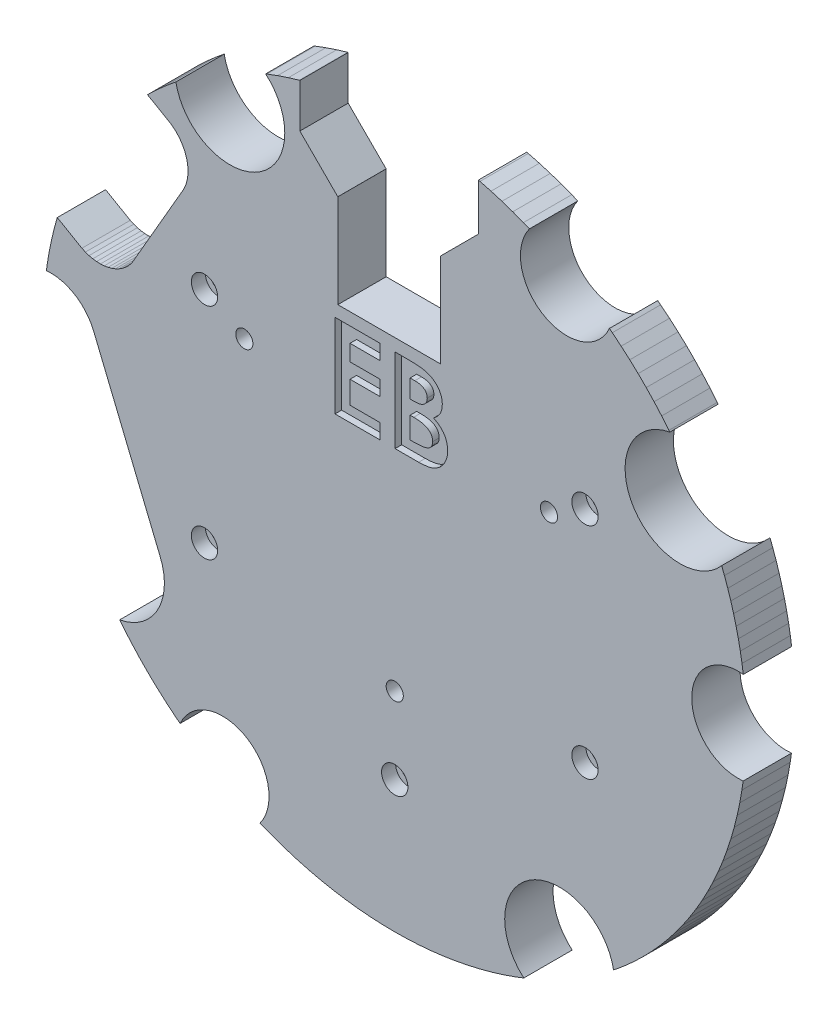
from build123d import *

# Parameters (mm, degrees)
DODANIE_WYCI_GNI_CIE1_DEPTH   = 5
DODANIE_WYCI_GNI_CIE1_2_DEPTH = 5
DODANIE_WYCI_GNI_CIE1_3_DEPTH = 5
DODANIE_WYCI_GNI_CIE1_4_DEPTH = 5
DODANIE_WYCI_GNI_CIE1_5_DEPTH = 5
DODANIE_WYCI_GNI_CIE1_6_DEPTH = 5
DODANIE_WYCI_GNI_CIE2_START   = 5
EB_R                          = 1.59999934
DODANIE_WYCI_GNI_CIE2_DEPTH   = 11
CUT_EXTRUDE2_DEPTH            = 1.5
CUT_EXTRUDE3_START            = -18
CUT_EXTRUDE3_DEPTH            = 18
SZKIC9_R                      = 72.406318029
WYTNIJ_WYCI_GNI_CIE3_DEPTH    = 5
SZKIC10_R                     = 1.95
WYTNIJ_WYCI_GNI_CIE4_DEPTH    = 6
SZKIC11_R                     = 1.6
WYTNIJ_WYCI_GNI_CIE5_DEPTH    = 114.216129925
SZKIC12_R                     = 3
WYTNIJ_WYCI_GNI_CIE6_DEPTH    = 3.2


with BuildPart() as part:
    # mandaryna baza → Dodanie-wyciągnięcie1 (new body)
    with BuildSketch(Plane.XY):
        with BuildLine():
            Line((16.907164233, 3.25), (54.903893305, 3.25))
            ThreePointArc((54.903893305, 3.25), (47.631397208, 27.5), (30.266529215, 45.923166368))
            Line((30.266529215, 45.923166368), (11.268164679, 13.017033731))
            ThreePointArc((11.268164679, 13.017033731), (11.268164679, 6.50567791), (16.907164233, 3.25))
        make_face()
    extrude(amount=DODANIE_WYCI_GNI_CIE1_DEPTH)



with BuildPart() as body_2:
    # mandaryna baza → Dodanie-wyci_gni_cie1 2 (new body)
    with BuildSketch(Plane.XY):
        with BuildLine():
            Line((5.638999554, 16.267033731), (24.63736409, 49.173166368))
            ThreePointArc((24.63736409, 49.173166368), (17.789613857, 52.043535995), (10.61764744, 53.9654108))
            Line((10.61764744, 53.9654108), (10.61764744, 36.95114998))
            Line((10.61764744, 36.95114998), (-13.15035256, 36.95114998))
            Line((-13.15035256, 36.95114998), (-13.15035256, 53.404758473))
            ThreePointArc((-13.15035256, 53.404758473), (-19.011956116, 51.609548774), (-24.63736409, 49.173166368))
            Line((-24.63736409, 49.173166368), (-5.638999554, 16.267033731))
            ThreePointArc((-5.638999554, 16.267033731), (0, 13.011355821), (5.638999554, 16.267033731))
        make_face()
    extrude(amount=DODANIE_WYCI_GNI_CIE1_2_DEPTH)


with BuildPart() as body_3:
    # mandaryna baza → Dodanie-wyci_gni_cie1 3 (new body)
    with BuildSketch(Plane.XY):
        with BuildLine():
            Line((-11.268164679, 13.017033731), (-30.266529215, 45.923166368))
            ThreePointArc((-30.266529215, 45.923166368), (-47.631397208, 27.5), (-54.903893305, 3.25))
            Line((-54.903893305, 3.25), (-16.907164233, 3.25))
            ThreePointArc((-16.907164233, 3.25), (-11.268164679, 6.50567791), (-11.268164679, 13.017033731))
        make_face()
    extrude(amount=DODANIE_WYCI_GNI_CIE1_3_DEPTH)


with BuildPart() as body_4:
    # mandaryna baza → Dodanie-wyci_gni_cie1 4 (new body)
    with BuildSketch(Plane.XY):
        with BuildLine():
            Line((-16.907164233, -3.25), (-54.903893305, -3.25))
            ThreePointArc((-54.903893305, -3.25), (-47.631397208, -27.5), (-30.266529215, -45.923166368))
            Line((-30.266529215, -45.923166368), (-11.268164679, -13.017033731))
            ThreePointArc((-11.268164679, -13.017033731), (-11.268164679, -6.50567791), (-16.907164233, -3.25))
        make_face()
    extrude(amount=DODANIE_WYCI_GNI_CIE1_4_DEPTH)


with BuildPart() as body_5:
    # mandaryna baza → Dodanie-wyci_gni_cie1 5 (new body)
    with BuildSketch(Plane.XY):
        with BuildLine():
            Line((-5.638999554, -16.267033731), (-24.63736409, -49.173166368))
            ThreePointArc((-24.63736409, -49.173166368), (0, -55), (24.63736409, -49.173166368))
            Line((24.63736409, -49.173166368), (5.638999554, -16.267033731))
            ThreePointArc((5.638999554, -16.267033731), (0, -13.011355821), (-5.638999554, -16.267033731))
        make_face()
    extrude(amount=DODANIE_WYCI_GNI_CIE1_5_DEPTH)


with BuildPart() as body_6:
    # mandaryna baza → Dodanie-wyci_gni_cie1 6 (new body)
    with BuildSketch(Plane.XY):
        with BuildLine():
            Line((11.268164679, -13.017033731), (30.266529215, -45.923166368))
            ThreePointArc((30.266529215, -45.923166368), (47.631397208, -27.5), (54.903893305, -3.25))
            Line((54.903893305, -3.25), (16.907164233, -3.25))
            ThreePointArc((16.907164233, -3.25), (11.268164679, -6.50567791), (11.268164679, -13.017033731))
        make_face()
    extrude(amount=DODANIE_WYCI_GNI_CIE1_6_DEPTH)


with BuildPart() as part_1:
    add(part.part)

    add(body_2.part)  # Dodanie-wyciągnięcie2 merges body 2

    add(body_3.part)  # Dodanie-wyciągnięcie2 merges body 3

    add(body_4.part)  # Dodanie-wyciągnięcie2 merges body 4

    add(body_5.part)  # Dodanie-wyciągnięcie2 merges body 5

    add(body_6.part)  # Dodanie-wyciągnięcie2 merges body 6
    # EB_ → Dodanie-wyciągnięcie2 (add)
    with BuildSketch(Plane.XY.offset(DODANIE_WYCI_GNI_CIE2_START)):
        with BuildLine():
            Line((-71.57962062, -7.983371532), (-71.312597874, -9.139973792))
            Line((-71.312597874, -9.139973792), (-68.53523504, -8.49876888))
            Line((-68.53523504, -8.49876888), (-68.19394794, -8.41997808))
            Line((-68.19394794, -8.41997808), (-67.49664428, -8.35283572))
            Line((-67.49664428, -8.35283572), (-66.79654408, -8.37728322))
            Line((-66.79654408, -8.37728322), (-66.10562344, -8.49290402))
            Line((-66.10562344, -8.49290402), (-65.43570352, -8.69771946))
            Line((-65.43570352, -8.69771946), (-64.79824988, -8.98822434))
            Line((-64.79824988, -8.98822434), (-64.20416928, -9.35944788))
            Line((-64.20416928, -9.35944788), (-63.66362426, -9.80504008))
            Line((-63.66362426, -9.80504008), (-63.1858655, -10.31737332))
            Line((-63.1858655, -10.31737332), (-62.77906926, -10.8876846))
            Line((-62.77906926, -10.8876846), (-62.45019006, -11.50621524))
            Line((-62.45019006, -11.50621524), (-62.20486162, -12.1623836))
            Line((-62.20486162, -12.1623836), (-62.1260632, -12.50366054))
            Line((-62.1260632, -12.50366054), (-61.33063934, -15.94903846))
            Line((-61.33063934, -15.94903846), (-61.25184854, -16.29032556))
            Line((-61.25184854, -16.29032556), (-61.18470618, -16.98762922))
            Line((-61.18470618, -16.98762922), (-61.20915368, -17.68772942))
            Line((-61.20915368, -17.68772942), (-61.32477448, -18.37865006))
            Line((-61.32477448, -18.37865006), (-61.52958738, -19.04856998))
            Line((-61.52958738, -19.04856998), (-61.82009226, -19.68602362))
            Line((-61.82009226, -19.68602362), (-62.1913158, -20.28010422))
            Line((-62.1913158, -20.28010422), (-62.63690546, -20.82064924))
            Line((-62.63690546, -20.82064924), (-63.14924124, -21.298408))
            Line((-63.14924124, -21.298408), (-63.71955252, -21.70520678))
            Line((-63.71955252, -21.70520678), (-64.33808062, -22.03408598))
            Line((-64.33808062, -22.03408598), (-64.99424644, -22.27941442))
            Line((-64.99424644, -22.27941442), (-65.33552338, -22.35820776))
            Line((-65.33552338, -22.35820776), (-76.05586516, -24.83318884))
            Line((-76.05586516, -24.83318884), (-75.54626496, -26.37281238))
            Line((-75.54626496, -26.37281238), (-74.65067366, -28.8104199))
            Line((-74.65067366, -28.8104199), (-74.417803039, -29.385834102))
            ThreePointArc((-74.417803039, -29.385834102), (-54.113072342, -31.273397893), (-62.609286236, -49.811448903))
            Line((-62.609286236, -49.811448903), (-61.8316772, -50.79288038))
            Line((-61.8316772, -50.79288038), (-60.00002478, -52.9440267))
            Line((-60.00002478, -52.9440267), (-58.09357698, -55.02916858))
            Line((-58.09357698, -55.02916858), (-56.11470362, -57.0457076))
            Line((-56.11470362, -57.0457076), (-54.06587612, -58.99113424))
            Line((-54.06587612, -58.99113424), (-51.94964972, -60.86301772))
            Line((-51.94964972, -60.86301772), (-49.7686584, -62.65902632))
            Line((-49.7686584, -62.65902632), (-48.854025047, -63.359525568))
            ThreePointArc((-48.854025047, -63.359525568), (-33.882392112, -58.494836786), (-30.664292357, -73.904535798))
            Line((-30.664292357, -73.904535798), (-30.33088422, -74.04802818))
            Line((-30.33088422, -74.04802818), (-27.69790498, -75.07262354))
            Line((-27.69790498, -75.07262354), (-25.03039952, -76.0036326))
            Line((-25.03039952, -76.0036326), (-22.33168762, -76.8398895))
            Line((-22.33168762, -76.8398895), (-19.60513732, -77.58035538))
            Line((-19.60513732, -77.58035538), (-16.8541446, -78.22410568))
            Line((-16.8541446, -78.22410568), (-14.082141, -78.77033776))
            Line((-14.082141, -78.77033776), (-11.29258346, -79.2183709))
            Line((-11.29258346, -79.2183709), (-8.4889467, -79.56764884))
            Line((-8.4889467, -79.56764884), (-5.6747283, -79.81773216))
            Line((-5.6747283, -79.81773216), (-2.85343346, -79.96831098))
            Line((-2.85343346, -79.96831098), (-0.02858516, -80.0191948))
            Line((-0.02858516, -80.0191948), (2.79630124, -79.97032774))
            Line((2.79630124, -79.97032774), (5.61770276, -79.82176568))
            Line((5.61770276, -79.82176568), (8.43209896, -79.5736915))
            Line((8.43209896, -79.5736915), (11.23598464, -79.22641762))
            Line((11.23598464, -79.22641762), (14.02586222, -78.78037838))
            Line((14.02586222, -78.78037838), (16.79825444, -78.23612496))
            Line((16.79825444, -78.23612496), (19.54970436, -77.59434062))
            Line((19.54970436, -77.59434062), (22.27678552, -76.85582292))
            Line((22.27678552, -76.85582292), (24.97609178, -76.02149388))
            Line((24.97609178, -76.02149388), (27.64426526, -75.09239236))
            Line((27.64426526, -75.09239236), (29.384476808, -74.416637255))
            ThreePointArc((29.384476808, -74.416637255), (31.276596816, -54.111223602), (49.812489526, -62.614788922))
            Line((49.812489526, -62.614788922), (50.20371976, -62.31071104))
            Line((50.20371976, -62.31071104), (52.35361386, -60.51559398))
            Line((52.35361386, -60.51559398), (54.43937042, -58.6463394))
            Line((54.43937042, -58.6463394), (56.45843166, -56.7052333))
            Line((56.45843166, -56.7052333), (58.40832616, -54.6946582))
            Line((58.40832616, -54.6946582), (60.28666124, -52.61707536))
            Line((60.28666124, -52.61707536), (62.0911382, -50.47502986))
            Line((62.0911382, -50.47502986), (63.8195447, -48.27114806))
            Line((63.8195447, -48.27114806), (65.46976746, -46.0081249))
            Line((65.46976746, -46.0081249), (67.03977956, -43.68873914))
            Line((67.03977956, -43.68873914), (68.52766076, -41.31582796))
            Line((68.52766076, -41.31582796), (69.93158734, -38.89229966))
            Line((69.93158734, -38.89229966), (71.24983972, -36.42112604))
            Line((71.24983972, -36.42112604), (72.48080246, -33.9053297))
            Line((72.48080246, -33.9053297), (73.6229668, -31.34799674))
            Line((73.6229668, -31.34799674), (74.6749332, -28.75225644))
            Line((74.6749332, -28.75225644), (75.63541642, -26.12129396))
            Line((75.63541642, -26.12129396), (76.50323536, -23.45832748))
            Line((76.50323536, -23.45832748), (77.2773283, -20.76662344))
            Line((77.2773283, -20.76662344), (77.95674782, -18.04947622))
            Line((77.95674782, -18.04947622), (78.5406608, -15.31021576))
            Line((78.5406608, -15.31021576), (79.02835096, -12.55219994))
            Line((79.02835096, -12.55219994), (79.299411436, -10.628909904))
            ThreePointArc((79.299411436, -10.628909904), (67.599207973, -0.09719794), (79.333602634, 10.39640487))
            Line((79.333602634, 10.39640487), (79.04494478, 12.42009454))
            Line((79.04494478, 12.42009454), (78.6613108, 14.6546951))
            Line((78.6613108, 14.6546951), (78.21451972, 16.87752784))
            Line((78.21451972, 16.87752784), (77.70492714, 19.08680968))
            Line((77.70492714, 19.08680968), (77.13294454, 21.28076516))
            Line((77.13294454, 21.28076516), (76.49902912, 23.45763406))
            Line((76.49902912, 23.45763406), (75.80368888, 25.61566886))
            Line((75.80368888, 25.61566886), (75.0474877, 27.75313728))
            Line((75.0474877, 27.75313728), (74.417433184, 29.385403446))
            ThreePointArc((74.417433184, 29.385403446), (54.111310063, 31.276447161), (62.61564958, 49.812652056))
            Line((62.61564958, 49.812652056), (62.41427192, 50.07219348))
            Line((62.41427192, 50.07219348), (60.75485182, 52.07315976))
            Line((60.75485182, 52.07315976), (59.03130942, 54.01916806))
            Line((59.03130942, 54.01916806), (57.2454659, 55.90816352))
            Line((57.2454659, 55.90816352), (55.3992034, 57.73815224))
            Line((55.3992034, 57.73815224), (53.49447264, 59.50720382))
            Line((53.49447264, 59.50720382), (51.53328276, 61.21345136))
            Line((51.53328276, 61.21345136), (49.5177064, 62.855094))
            Line((49.5177064, 62.855094), (48.854412275, 63.360399614))
            ThreePointArc((48.854412275, 63.360399614), (33.885789996, 58.492867797), (30.660209654, 73.898975364))
            Line((30.660209654, 73.898975364), (29.29812276, 74.46063594))
            Line((29.29812276, 74.46063594), (26.86397218, 75.3730268))
            Line((26.86397218, 75.3730268), (24.40147012, 76.2058674))
            Line((24.40147012, 76.2058674), (21.913215, 76.95828144))
            Line((21.913215, 76.95828144), (19.40183064, 77.6294739))
            Line((19.40183064, 77.6294739), (19.04364746, 77.7128367))
            Line((19.04364746, 77.7128367), (19.04365, 67.0536505))
            Line((19.04365, 67.0536505), (10.41764998, 58.42765048))
            Line((10.41764998, 58.42765048), (10.41764998, 37.15114998))
            Line((10.41764998, 37.15114998), (-12.95035002, 37.15114998))
            Line((-12.95035002, 37.15114998), (-12.95035256, 58.4176505))
            Line((-12.95035256, 58.4176505), (-12.96035, 58.4176505))
            Line((-12.96035, 58.4176505), (-21.59635, 67.0536505))
            Line((-21.59635, 67.0536505), (-21.59635254, 77.04573364))
            Line((-21.59635254, 77.04573364), (-21.72109448, 77.01272888))
            Line((-21.72109448, 77.01272888), (-24.21122158, 76.26652768))
            Line((-24.21122158, 76.26652768), (-26.67579374, 75.43983134))
            Line((-26.67579374, 75.43983134), (-29.11221254, 74.5335187))
            Line((-29.11221254, 74.5335187), (-29.388740405, 74.420298138))
            ThreePointArc((-29.388740405, 74.420298138), (-31.275994816, 54.111571417), (-49.813273742, 62.618944704))
            Line((-49.813273742, 62.618944704), (-49.89862766, 62.55309562))
            Line((-49.89862766, 62.55309562), (-51.90221522, 60.90092722))
            Line((-51.90221522, 60.90092722), (-53.85113436, 59.18461366))
            Line((-53.85113436, 59.18461366), (-55.74333022, 57.40595834))
            Line((-55.74333022, 57.40595834), (-56.27645844, 56.87119182))
            Line((-56.27645844, 56.87119182), (-51.51362062, 54.1213675))
            Line((-51.51362062, 54.1213675), (-51.13540192, 53.90299608))
            Line((-51.13540192, 53.90299608), (-50.4254008, 53.3942163))
            Line((-50.4254008, 53.3942163), (-49.76868634, 52.81829416))
            Line((-49.76868634, 52.81829416), (-49.17158314, 52.18077702))
            Line((-49.17158314, 52.18077702), (-48.6398443, 51.48780152))
            Line((-48.6398443, 51.48780152), (-48.17859046, 50.74604532))
            Line((-48.17859046, 50.74604532), (-47.79226154, 49.96264836))
            Line((-47.79226154, 49.96264836), (-47.48457864, 49.14515698))
            Line((-47.48457864, 49.14515698), (-47.25850594, 48.30144518))
            Line((-47.25850594, 48.30144518), (-47.11622022, 47.43963588))
            Line((-47.11622022, 47.43963588), (-47.05909308, 46.5680298))
            Line((-47.05909308, 46.5680298), (-47.08767062, 45.69502164))
            Line((-47.08767062, 45.69502164), (-47.2016836, 44.8290188))
            Line((-47.2016836, 44.8290188), (-47.40002966, 43.97836264))
            Line((-47.40002966, 43.97836264), (-47.68079872, 43.15124212))
            Line((-47.68079872, 43.15124212), (-48.04128822, 42.35562268))
            Line((-48.04128822, 42.35562268), (-48.2596571, 41.9773989))
            Line((-48.2596571, 41.9773989), (-59.43565202, 22.62000048))
            Line((-59.43565202, 22.62000048), (-59.65402598, 22.24177416))
            Line((-59.65402598, 22.24177416), (-60.16280576, 21.53177304))
            Line((-60.16280576, 21.53177304), (-60.7387279, 20.87506112))
            Line((-60.7387279, 20.87506112), (-61.37624758, 20.27795792))
            Line((-61.37624758, 20.27795792), (-62.06922054, 19.74622162))
            Line((-62.06922054, 19.74622162), (-62.81097928, 19.28496778))
            Line((-62.81097928, 19.28496778), (-63.5943737, 18.89863886))
            Line((-63.5943737, 18.89863886), (-64.41186508, 18.59095596))
            Line((-64.41186508, 18.59095596), (-65.25557688, 18.3648858))
            Line((-65.25557688, 18.3648858), (-66.11738618, 18.22260008))
            Line((-66.11738618, 18.22260008), (-66.98898972, 18.16547294))
            Line((-66.98898972, 18.16547294), (-67.86199788, 18.19405048))
            Line((-67.86199788, 18.19405048), (-68.72800072, 18.30806346))
            Line((-68.72800072, 18.30806346), (-69.57865688, 18.50640698))
            Line((-69.57865688, 18.50640698), (-70.4057774, 18.78717858))
            Line((-70.4057774, 18.78717858), (-71.2013943, 19.14766554))
            Line((-71.2013943, 19.14766554), (-71.57962062, 19.36603442))
            Line((-71.57962062, 19.36603442), (-76.81740034, 22.39006698))
            Line((-76.81740034, 22.39006698), (-76.88341494, 22.17438796))
            Line((-76.88341494, 22.17438796), (-77.56249156, 19.66782198))
            Line((-77.56249156, 19.66782198), (-78.15986908, 17.14053976))
            Line((-78.15986908, 17.14053976), (-78.67492266, 14.59520068))
            Line((-78.67492266, 14.59520068), (-79.1071062, 12.03449206))
            Line((-79.1071062, 12.03449206), (-79.289748918, 10.687222926))
            ThreePointArc((-79.289748918, 10.687222926), (-68.55606183, 4.192492209), (-71.57962062, -7.983371532))
        make_face()
        with Locations((0, -32.5400162)):
            Circle(EB_R, mode=Mode.SUBTRACT)
        with Locations((35.10868772, 20.27001026)):
            Circle(EB_R, mode=Mode.SUBTRACT)
        with Locations((-34.24266202, 19.77001126)):
            Circle(EB_R, mode=Mode.SUBTRACT)
    extrude(amount=DODANIE_WYCI_GNI_CIE2_DEPTH)

    # Sketch2 → Cut-Extrude2 (cut)
    # profile 1 of 2: a face of its own
    with BuildSketch(Plane.XY.offset(16)):
        Polygon((-13.600003866, 34.337145023), (-3.342311558, 34.337145023), (-3.342311558, 30.917914253), (-10.180773097, 30.917914253), (-10.180773097, 27.254452715), (-3.342311558, 27.254452715), (-3.342311558, 23.835221946), (-10.180773097, 23.835221946), (-10.180773097, 18.706375792), (-3.342311558, 18.706375792), (-3.342311558, 15.287145023), (-13.600003866, 15.287145023), align=None)
    # profile 2 of 2: a face of its own
    with BuildSketch(Plane.XY.offset(16)):
        with BuildLine():
            Line((0.076919211, 15.287145023), (0.076919211, 34.337145023))
            Line((0.076919211, 34.337145023), (3.129803826, 34.337145023))
            add(Edge.make_bspline(
                [(3.129803826, 34.337145023), (3.343524838, 34.337169414), (3.757070944, 34.337216609), (4.35371005, 34.316264603), (4.907042433, 34.289160835), (5.415307174, 34.258838022), (5.879369377, 34.206585756), (6.298523358, 34.151517576), (6.67360659, 34.085108744), (6.905500171, 34.025537965), (7.014599499, 33.997511609)],
                knots=[0, 0, 0, 0, 1.311965854, 2.538629056, 3.664479157, 4.713267157, 5.663616078, 6.530575999, 7.308677837, 8, 8, 8, 8], degree=3))
            add(Edge.make_bspline(
                [(7.014599499, 33.997511609), (7.157857994, 33.957979935), (7.438977152, 33.880406099), (7.841629496, 33.723742386), (8.223601412, 33.549599561), (8.584426522, 33.350935168), (8.921889216, 33.125350771), (9.23470702, 32.871056063), (9.529626642, 32.598258425), (9.796176157, 32.299355062), (10.037093002, 31.98350829), (10.246406546, 31.65080087), (10.428273188, 31.306320116), (10.573814138, 30.945730966), (10.68347651, 30.57069403), (10.763683111, 30.182810775), (10.815667849, 29.780853842), (10.820579725, 29.507389403), (10.823073057, 29.368575311)],
                knots=[0, 0, 0, 0, 1.099996261, 2.158545794, 3.195537121, 4.207578794, 5.205712374, 6.197378256, 7.190519799, 8.17788031, 9.159561366, 10.129234751, 11.085776129, 12.040971148, 13.00380137, 13.975669004, 14.972423361, 16, 16, 16, 16], degree=3))
            add(Edge.make_bspline(
                [(10.823073057, 29.368575311), (10.816553735, 29.190235639), (10.80372125, 28.839195907), (10.721746465, 28.323582052), (10.56803097, 27.836252847), (10.366897984, 27.368227001), (10.093420006, 26.921250252), (9.746155864, 26.495535125), (9.330730101, 26.077973214), (9.012075608, 25.827673015), (8.846330268, 25.697481561)],
                knots=[0, 0, 0, 0, 0.986156485, 1.941127874, 2.875419072, 3.804401753, 4.751181392, 5.761612777, 6.835722519, 8, 8, 8, 8], degree=3))
            add(Edge.make_bspline(
                [(8.846330268, 25.697481561), (8.98064234, 25.628916413), (9.243991153, 25.494479128), (9.617869101, 25.273504363), (9.964039268, 25.038469674), (10.284053777, 24.794104055), (10.571199958, 24.530048493), (10.837334558, 24.261518232), (11.069327877, 23.973127604), (11.276783295, 23.675155401), (11.457100173, 23.363286951), (11.61413629, 23.038048929), (11.746779065, 22.698330252), (11.859104398, 22.345859811), (11.942876661, 21.979425275), (11.997497958, 21.598895591), (12.039319437, 21.205568558), (12.042572755, 20.937644005), (12.044226903, 20.801417859)],
                knots=[0, 0, 0, 0, 1.164658916, 2.283573913, 3.35186032, 4.395461096, 5.390182219, 6.362969632, 7.312859996, 8.245001507, 9.165155236, 10.092416118, 11.032087915, 11.979892451, 12.947605196, 13.931445124, 14.948243989, 16, 16, 16, 16], degree=3))
            add(Edge.make_bspline(
                [(12.044226903, 20.801417859), (12.033492585, 20.541233709), (12.012308452, 20.027761333), (11.857420409, 19.273865957), (11.588893758, 18.559104762), (11.228317837, 17.886318516), (10.784018927, 17.274983275), (10.27320259, 16.739458912), (9.701011577, 16.286149427), (9.173096209, 15.980200691), (8.71649099, 15.774880479), (8.338293417, 15.647938577), (7.932117241, 15.53033979), (7.490522289, 15.447759494), (7.021514075, 15.372172926), (6.52051974, 15.325504214), (5.988475633, 15.293877977), (5.623044742, 15.289434715), (5.434731711, 15.287145023)],
                knots=[0, 0, 0, 0, 1.284142165, 2.534249414, 3.780121997, 5.041676246, 6.291546858, 7.49970053, 8.684500223, 9.883330709, 10.50184324, 11.153274765, 11.851151195, 12.587658647, 13.369265475, 14.195992086, 15.070362669, 16, 16, 16, 16], degree=3))
            Line((5.434731711, 15.287145023), (0.076919211, 15.287145023))
        make_face()
        with BuildLine():
            Line((3.49614998, 30.917914253), (3.49614998, 26.765991176))
            Line((3.49614998, 26.765991176), (4.404383153, 26.765991176))
            add(Edge.make_bspline(
                [(4.404383153, 26.765991176), (4.527820201, 26.767067594), (4.766107953, 26.769145554), (5.110289334, 26.795908949), (5.430322435, 26.841568963), (5.72499344, 26.905276169), (5.997047316, 26.986175031), (6.244746104, 27.083513786), (6.467000718, 27.202277646), (6.725209175, 27.379181658), (6.998154133, 27.63950383), (7.238424511, 28.015593145), (7.379942159, 28.448094426), (7.395703408, 28.753127819), (7.403842288, 28.910642619)],
                knots=[0, 0, 0, 0, 1.065314748, 2.056525647, 2.977365736, 3.853934255, 4.656397591, 5.425096493, 6.14721249, 6.826394842, 8.123232004, 9.372140726, 10.643011755, 12, 12, 12, 12], degree=3))
            add(Edge.make_bspline(
                [(7.403842288, 28.910642619), (7.397329694, 29.0581814), (7.384737856, 29.343441704), (7.24224778, 29.743972576), (7.020932522, 30.098924902), (6.759638752, 30.341860741), (6.513579895, 30.507778757), (6.302889202, 30.617028705), (6.071640345, 30.714828142), (5.815356595, 30.789607975), (5.535501471, 30.845720129), (5.233434388, 30.886927786), (4.908634175, 30.914975471), (4.684293976, 30.916913647), (4.568475701, 30.917914253)],
                knots=[0, 0, 0, 0, 1.347982417, 2.606269829, 3.849316587, 5.153353503, 5.842674298, 6.568177932, 7.326619318, 8.142485038, 9.012069166, 9.942760135, 10.937925643, 12, 12, 12, 12], degree=3))
            Line((4.568475701, 30.917914253), (3.49614998, 30.917914253))
        make_face(mode=Mode.SUBTRACT)
        with BuildLine():
            Line((3.49614998, 23.590991176), (3.49614998, 18.706375792))
            Line((3.49614998, 18.706375792), (4.480705268, 18.706375792))
            add(Edge.make_bspline(
                [(4.480705268, 18.706375792), (4.675353103, 18.707487808), (5.049587853, 18.709625797), (5.585678469, 18.735457791), (6.073118862, 18.782015409), (6.510617498, 18.840138844), (6.89884449, 18.918887008), (7.236487538, 19.019005206), (7.528176977, 19.129152662), (7.772163824, 19.265197848), (7.971487101, 19.423520708), (8.15135546, 19.585330473), (8.298008912, 19.771993326), (8.41404386, 19.975496345), (8.514471902, 20.19078437), (8.575043006, 20.426264321), (8.621159718, 20.674957136), (8.623697644, 20.846972578), (8.624996134, 20.934981561)],
                knots=[0, 0, 0, 0, 1.753078804, 3.370512758, 4.83203934, 6.162291463, 7.344201807, 8.395507345, 9.331626367, 10.147333109, 10.898971645, 11.62040215, 12.321813352, 13.025280112, 13.727906689, 14.453419512, 15.208716525, 16, 16, 16, 16], degree=3))
            add(Edge.make_bspline(
                [(8.624996134, 20.934981561), (8.622132591, 21.035621218), (8.61655518, 21.231640196), (8.571004399, 21.518142852), (8.488223748, 21.785612091), (8.383957481, 22.040887462), (8.238865429, 22.274829218), (8.066428485, 22.495533195), (7.858080635, 22.695525676), (7.623781324, 22.886902954), (7.350494374, 23.054464129), (7.038091567, 23.199853128), (6.684875761, 23.321276666), (6.289752834, 23.417954167), (5.854454972, 23.500003025), (5.375804981, 23.548995251), (4.857789222, 23.585432923), (4.498588665, 23.589096326), (4.312796615, 23.590991176)],
                knots=[0, 0, 0, 0, 0.845221588, 1.646264278, 2.427170338, 3.19324141, 3.95557735, 4.731569926, 5.540061037, 6.376114724, 7.268642756, 8.224665384, 9.265483498, 10.400594375, 11.639216012, 12.983232105, 14.439614077, 16, 16, 16, 16], degree=3))
            Line((4.312796615, 23.590991176), (3.49614998, 23.590991176))
        make_face(mode=Mode.SUBTRACT)
    extrude(amount=-CUT_EXTRUDE2_DEPTH, mode=Mode.SUBTRACT)

    # Sketch4 → Cut-Extrude3 (cut)
    with BuildSketch(Plane.XY.offset(16).offset(CUT_EXTRUDE3_START)):
        with BuildLine():
            Line((-68.548215578, 4.173439387), (-53.371866768, -32.7810546))
            ThreePointArc((-53.371866768, -32.7810546), (-62.943953417, -25.18922005), (-74.417803039, -29.385834102))
            Line((-74.417803039, -29.385834102), (-74.65067366, -28.8104199))
            Line((-74.65067366, -28.8104199), (-75.54626496, -26.37281238))
            Line((-75.54626496, -26.37281238), (-76.05586516, -24.83318884))
            Line((-76.05586516, -24.83318884), (-65.33552338, -22.35820776))
            Line((-65.33552338, -22.35820776), (-64.99424644, -22.27941442))
            Line((-64.99424644, -22.27941442), (-64.33808062, -22.03408598))
            Line((-64.33808062, -22.03408598), (-63.71955252, -21.70520678))
            Line((-63.71955252, -21.70520678), (-63.14924124, -21.298408))
            Line((-63.14924124, -21.298408), (-62.63690546, -20.82064924))
            Line((-62.63690546, -20.82064924), (-62.1913158, -20.28010422))
            Line((-62.1913158, -20.28010422), (-61.82009226, -19.68602362))
            Line((-61.82009226, -19.68602362), (-61.52958738, -19.04856998))
            Line((-61.52958738, -19.04856998), (-61.32477448, -18.37865006))
            Line((-61.32477448, -18.37865006), (-61.20915368, -17.68772942))
            Line((-61.20915368, -17.68772942), (-61.18470618, -16.98762922))
            Line((-61.18470618, -16.98762922), (-61.25184854, -16.29032556))
            Line((-61.25184854, -16.29032556), (-61.33063934, -15.94903846))
            Line((-61.33063934, -15.94903846), (-62.1260632, -12.50366054))
            Line((-62.1260632, -12.50366054), (-62.20486162, -12.1623836))
            Line((-62.20486162, -12.1623836), (-62.45019006, -11.50621524))
            Line((-62.45019006, -11.50621524), (-62.77906926, -10.8876846))
            Line((-62.77906926, -10.8876846), (-63.1858655, -10.31737332))
            Line((-63.1858655, -10.31737332), (-63.66362426, -9.80504008))
            Line((-63.66362426, -9.80504008), (-64.20416928, -9.35944788))
            Line((-64.20416928, -9.35944788), (-64.79824988, -8.98822434))
            Line((-64.79824988, -8.98822434), (-65.43570352, -8.69771946))
            Line((-65.43570352, -8.69771946), (-66.10562344, -8.49290402))
            Line((-66.10562344, -8.49290402), (-66.79654408, -8.37728322))
            Line((-66.79654408, -8.37728322), (-67.49664428, -8.35283572))
            Line((-67.49664428, -8.35283572), (-68.19394794, -8.41997808))
            Line((-68.19394794, -8.41997808), (-68.53523504, -8.49876888))
            Line((-68.53523504, -8.49876888), (-71.312597874, -9.139973792))
            Line((-71.312597874, -9.139973792), (-71.57962062, -7.983371532))
            ThreePointArc((-71.57962062, -7.983371532), (-68.069644092, -2.402255396), (-68.548215578, 4.173439387))
        make_face()
    extrude(amount=CUT_EXTRUDE3_DEPTH, mode=Mode.SUBTRACT)

    # Szkic9 → Wytnij-wyciągnięcie3 (cut)
    with BuildSketch(Plane(origin=(0, 0, 5), x_dir=(-1, 0, 0), z_dir=(0, 0, -1))):
        Circle(SZKIC9_R)
    extrude(amount=WYTNIJ_WYCI_GNI_CIE3_DEPTH, mode=Mode.SUBTRACT)

    # Szkic10 → Wytnij-wyciągnięcie4 (cut)
    with BuildSketch(Plane.XY.offset(16)):
        with Locations((-34.24266202, 19.77001126)):
            Circle(SZKIC10_R)
        with Locations((35.10868772, 20.27001026)):
            Circle(SZKIC10_R)
        with Locations((0, -32.5400162)):
            Circle(SZKIC10_R)
    extrude(amount=-WYTNIJ_WYCI_GNI_CIE4_DEPTH, mode=Mode.SUBTRACT)

    # Szkic11 → Wytnij-wyciągnięcie5 (cut, through all)
    with BuildSketch(Plane.XY.offset(16)):
        with Locations((0, -50)):
            Circle(SZKIC11_R)
        with Locations((-43.301270189, -25)):
            Circle(SZKIC11_R)
        with Locations((-43.301270189, 25)):
            Circle(SZKIC11_R)
        with Locations((0, 50)):
            Circle(SZKIC11_R)
        with Locations((43.301270189, 25)):
            Circle(SZKIC11_R)
        with Locations((43.301270189, -25)):
            Circle(SZKIC11_R)
    extrude(amount=-WYTNIJ_WYCI_GNI_CIE5_DEPTH, mode=Mode.SUBTRACT)

    # Szkic12 → Wytnij-wyciągnięcie6 (cut)
    with BuildSketch(Plane.XY.offset(16)):
        with Locations((0, -50)):
            Circle(SZKIC12_R)
        with Locations((-43.301270189, -25)):
            Circle(SZKIC12_R)
        with Locations((-43.301270189, 25)):
            Circle(SZKIC12_R)
        with Locations((0, 50)):
            Circle(SZKIC12_R)
        with Locations((43.301270189, 25)):
            Circle(SZKIC12_R)
        with Locations((43.301270189, -25)):
            Circle(SZKIC12_R)
    extrude(amount=-WYTNIJ_WYCI_GNI_CIE6_DEPTH, mode=Mode.SUBTRACT)


solid = part_1.part
